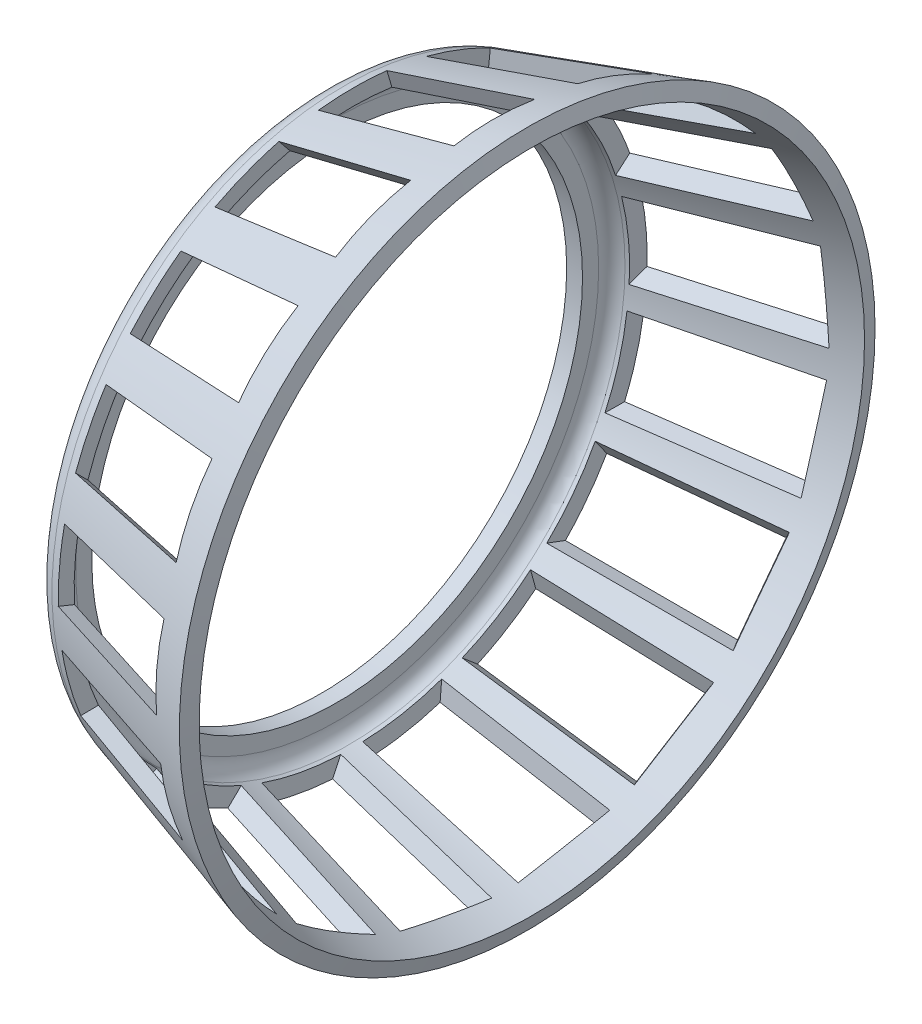
from build123d import *

# Parameters (mm, degrees)
ENL_V_MAT_EXTRU_1_DEPTH      = 2
ENL_V_MAT_EXTRU_1_TAPER      = -20
R_P_TITION_CIRCULAIRE1_COUNT = 17


with BuildPart() as part:
    # Esquisse1 → Base-Révolution (revolve)
    with BuildSketch(Plane.XY, mode=Mode.PRIVATE) as base_r_volution_sk:
        with BuildLine():
            Line((-13.691663375, 18.432687362), (-2.101175284, 21.976255184))
            Line((-2.101175284, 21.976255184), (-1.80880358, 21.019950428))
            Line((-1.80880358, 21.019950428), (-13.39929167, 17.476382606))
            ThreePointArc((-13.39929167, 17.476382606), (-13.910776826, 17.114900637), (-14.106919966, 16.52007785))
            Line((-14.106919966, 16.52007785), (-14.106919966, 15.5))
            Line((-14.106919966, 15.5), (-15.106919966, 15.5))
            Line((-15.106919966, 15.5), (-15.106919966, 16.52007785))
            ThreePointArc((-15.106919966, 16.52007785), (-14.714633687, 17.709723423), (-13.691663375, 18.432687362))
        make_face()
    revolve(base_r_volution_sk.sketch.rotate(Axis((0, 0, 0), (-1, 0, 0)), 90), axis=Axis((0, 0, 0), (-1, 0, 0)))

    # Esquisse4 → Enlèv. mat.-Extru.1 (cut)
    with BuildSketch(Plane(origin=(-7.89641933, 20.204471273, 0), x_dir=(0, 0, -1), z_dir=(-0.2923717047227308, 0.9563047559630373, 0))):
        Polygon((2.125, 5.464852104), (-2.125, 5.464852104), (-2.48843349, -3.785147896), (2.48843349, -3.785147896), align=None)
    enl_v_mat_extru_1 = extrude(amount=-ENL_V_MAT_EXTRU_1_DEPTH, taper=ENL_V_MAT_EXTRU_1_TAPER, mode=Mode.SUBTRACT)

    # Répétition circulaire1: Enlèv. mat.-Extru.1 ×17 about axis
    r_p_tition_circulaire1_axis = Axis((0, 0, 0), (-1, 0, 0))
    for i in range(1, R_P_TITION_CIRCULAIRE1_COUNT):
        add(enl_v_mat_extru_1.rotate(r_p_tition_circulaire1_axis, i * 360 / R_P_TITION_CIRCULAIRE1_COUNT), mode=Mode.SUBTRACT)


solid = part.part
